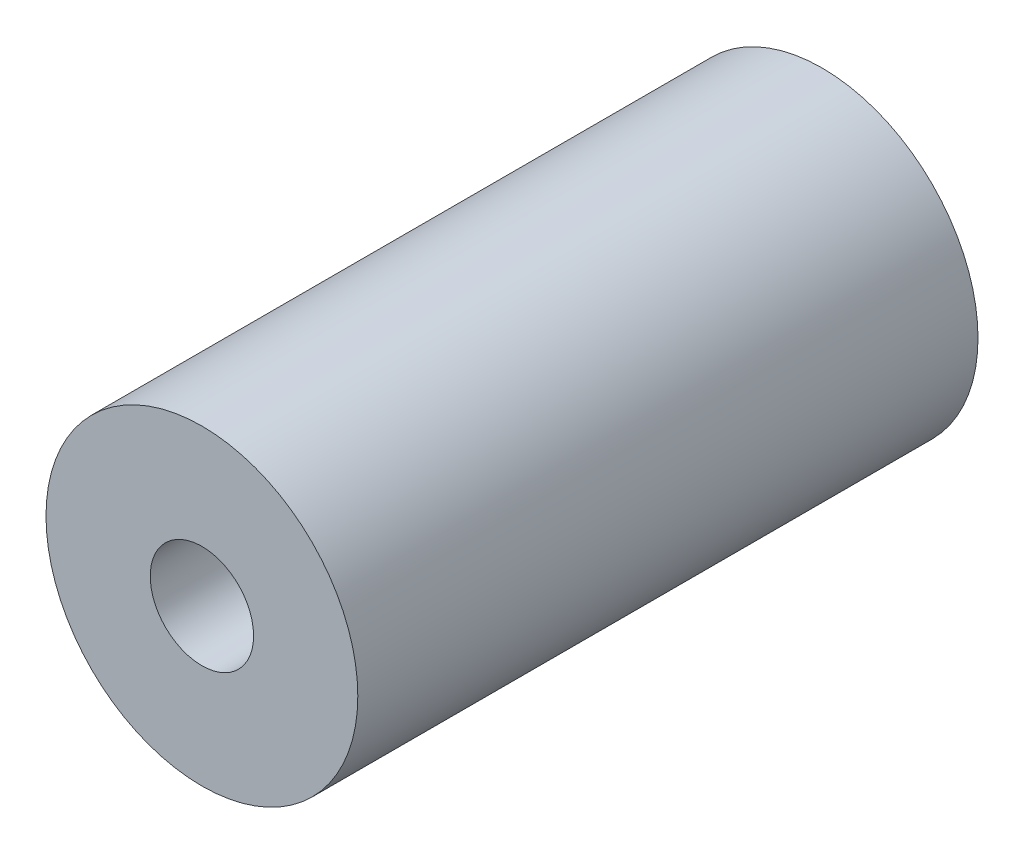
from build123d import *

# Parameters (mm, degrees)
SKETCH1_R           = 4.525
BOSS_EXTRUDE1_DEPTH = 18
SKETCH2_R           = 1.5
CUT_EXTRUDE1_DEPTH  = 18


with BuildPart() as part:
    # Sketch1 → Boss-Extrude1 (new body)
    with BuildSketch(Plane.XY):
        with Locations((-63.594144036, 24.9570042)):
            Circle(SKETCH1_R)
    extrude(amount=BOSS_EXTRUDE1_DEPTH)

    # Sketch2 → Cut-Extrude1 (cut)
    with BuildSketch(Plane.XY.offset(18)):
        with Locations((-63.594144036, 24.9570042)):
            Circle(SKETCH2_R)
    extrude(amount=-CUT_EXTRUDE1_DEPTH, mode=Mode.SUBTRACT)


solid = part.part
